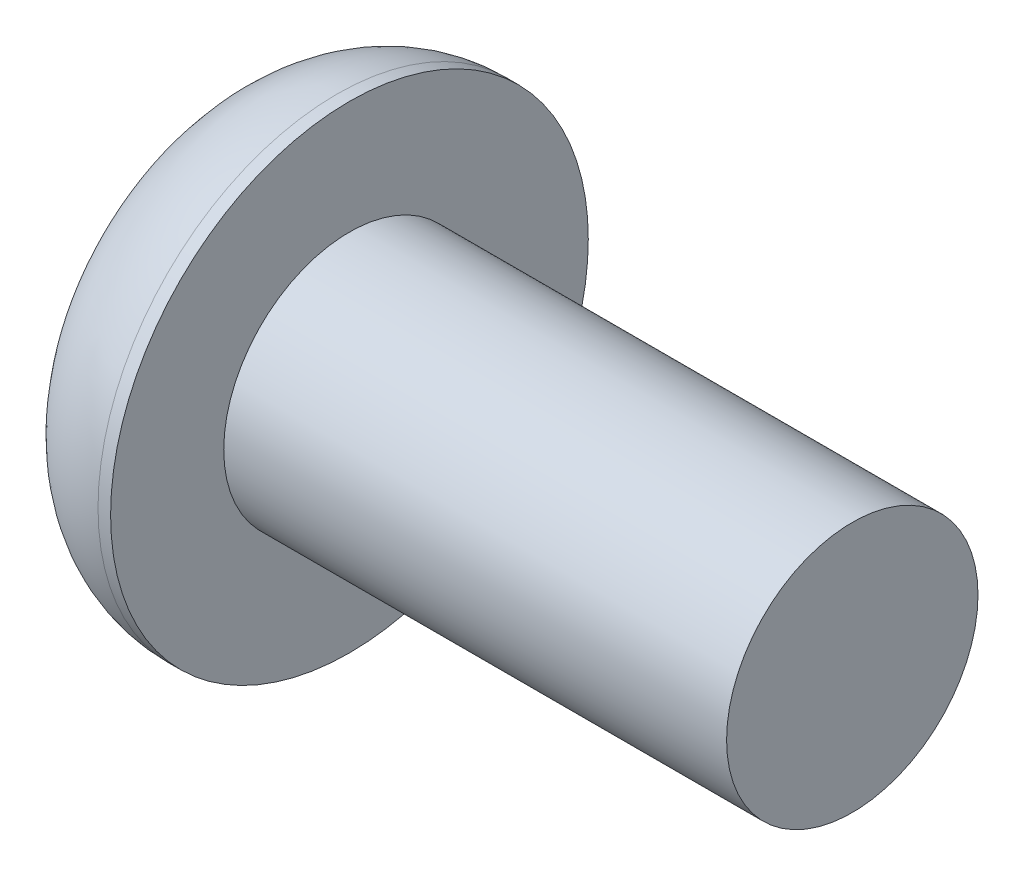
from build123d import *

# Parameters (mm, degrees)
CUT_EXTRUDE1_DEPTH = 1.56


with BuildPart() as part:
    # Sketch1 → Revolve1 (revolve)
    with BuildSketch(Plane(origin=(0, 0, 0), x_dir=(1, 0, 0), z_dir=(0, 1, 0))):
        with BuildLine():
            Line((0, 0), (12.75, 0))
            Line((12.75, 0), (12.75, 2.5))
            Line((12.75, 2.5), (2.75, 2.5))
            Line((2.75, 2.5), (2.75, 4.75))
            Line((2.75, 4.75), (2.5, 4.75))
            ThreePointArc((2.5, 4.75), (0.732233047, 4.017766953), (0, 2.25))
            Line((0, 2.25), (0, 0))
        make_face()
    revolve(axis=Axis((0, 0, 0), (-1, 0, 0)))

    # Sketch2 → Cut-Extrude1 (cut)
    with BuildSketch(Plane.ZY):
        Polygon((1.732050808, 0), (0.866025404, 1.5), (-0.866025404, 1.5), (-1.732050808, 0), (-0.866025404, -1.5), (0.866025404, -1.5), align=None)
    extrude(amount=-CUT_EXTRUDE1_DEPTH, mode=Mode.SUBTRACT)


solid = part.part
